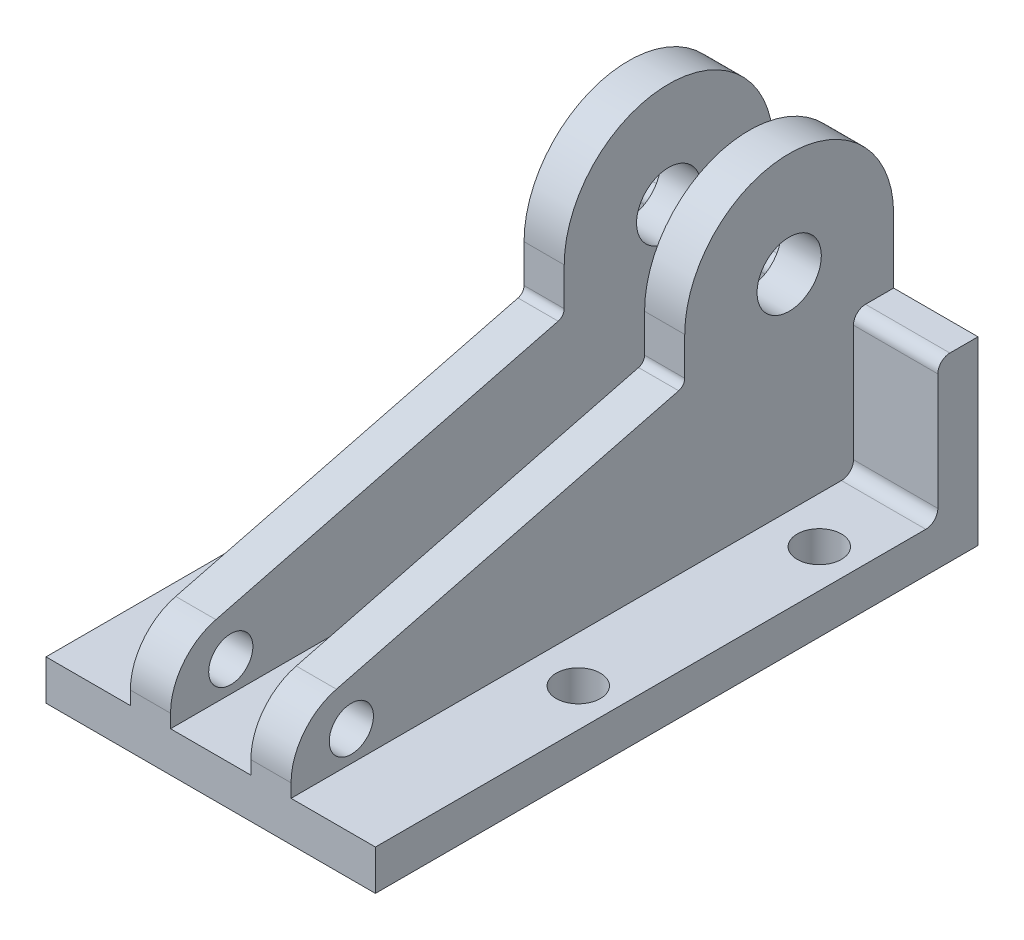
from build123d import *

# Parameters (mm, degrees)
SKETCH1_W                = 82
SKETCH1_H                = 150
BOSS_EXTRUDE1_DEPTH      = 10
SKETCH2_W                = 10
SKETCH2_H                = 45
BOSS_EXTRUDE2_DEPTH      = 82
BOSS_EXTRUDE3_DEPTH      = 42
BOSS_EXTRUDE3_DEPTH_BACK = 10
FILLET3_RADIUS           = 26
FILLET3_LENGTH           = 10
FILLET4_RADIUS           = 26
FILLET4_LENGTH           = 10
BOSS_EXTRUDE4_DEPTH      = 10
BOSS_EXTRUDE5_DEPTH      = 10
FILLET5_R                = 15
FILLET6_R                = 15
SKETCH6_R                = 8
SKETCH6_R_2              = 5.5
CUT_EXTRUDE1_DEPTH       = 131.057679512
FILLET7_R                = 3
FILLET8_R                = 3
FILLET9_R                = 3
FILLET10_R               = 3
FILLET11_R               = 2
SKETCH7_R                = 5.5
CUT_EXTRUDE2_DEPTH       = 116.043470045


with BuildPart() as part:
    # Sketch1 → Boss-Extrude1 (new body)
    with BuildSketch(Plane(origin=(0, 0, 0), x_dir=(1, 0, 0), z_dir=(0, 1, 0))):
        Rectangle(SKETCH1_W, SKETCH1_H)
    extrude(amount=BOSS_EXTRUDE1_DEPTH)

    # Sketch2 → Boss-Extrude2 (add, through all)
    with BuildSketch(Plane(origin=(41, 0, 0), x_dir=(0, 0, -1), z_dir=(1, 0, 0))):
        with Locations((70, 22.5)):
            Rectangle(SKETCH2_W, SKETCH2_H)
    extrude(amount=-BOSS_EXTRUDE2_DEPTH)

    # Sketch3 → Boss-Extrude3 (add, two sides: drawn at the far end of the back side and taken through both)
    with BuildSketch(Plane.XY.offset(-65).offset(-BOSS_EXTRUDE3_DEPTH_BACK)):
        Polygon((10, 45), (10, 10), (20, 10), (20, 45), (20, 87), (10, 87), align=None)
        Polygon((-10, 45), (-10, 87), (-20, 87), (-20, 45), (-20, 10), (-10, 10), align=None)
    extrude(amount=BOSS_EXTRUDE3_DEPTH + BOSS_EXTRUDE3_DEPTH_BACK)

    # Fillet3: full round fillet: the end face becomes a half cylinder, R = half its width
    fillet3_face = Plane((15, 87, -49), x_dir=(-1, 0, 0), z_dir=(0, 1, 0))  # on the end face: x along it, z out of the body
    fillet3_slab = fillet3_face.offset(-FILLET3_RADIUS / 2) * Box(FILLET3_LENGTH, 2 * FILLET3_RADIUS, FILLET3_RADIUS, mode=Mode.PRIVATE)  # the body's end, R deep
    fillet3_round = Plane((15, 61, -49), x_dir=(0, 1, 0), z_dir=(-1, 0, 0)) * Cylinder(FILLET3_RADIUS, FILLET3_LENGTH, mode=Mode.PRIVATE)  # its axis R under the face
    add(fillet3_slab - fillet3_round, mode=Mode.SUBTRACT)

    # Fillet4: full round fillet: the end face becomes a half cylinder, R = half its width
    fillet4_face = Plane((-15, 87, -49), x_dir=(-1, 0, 0), z_dir=(0, 1, 0))  # on the end face: x along it, z out of the body
    fillet4_slab = fillet4_face.offset(-FILLET4_RADIUS / 2) * Box(FILLET4_LENGTH, 2 * FILLET4_RADIUS, FILLET4_RADIUS, mode=Mode.PRIVATE)  # the body's end, R deep
    fillet4_round = Plane((-15, 61, -49), x_dir=(0, 1, 0), z_dir=(-1, 0, 0)) * Cylinder(FILLET4_RADIUS, FILLET4_LENGTH, mode=Mode.PRIVATE)  # its axis R under the face
    add(fillet4_slab - fillet4_round, mode=Mode.SUBTRACT)

    # Sketch4 → Boss-Extrude4 (add)
    with BuildSketch(Plane(origin=(20, 0, 0), x_dir=(0, 0, -1), z_dir=(1, 0, 0))):
        Polygon((23, 10), (23, 50), (-75, 25), (-75, 10), align=None)
    extrude(amount=-BOSS_EXTRUDE4_DEPTH)

    # Sketch5 → Boss-Extrude5 (add)
    with BuildSketch(Plane.ZY.offset(20)):
        Polygon((-23, 50), (75, 25), (75, 10), (-23, 10), align=None)
    extrude(amount=-BOSS_EXTRUDE5_DEPTH)

    # Fillet5
    fillet5_edges = [part.edges().sort_by_distance(p)[0] for p in [
        (15, 25, 75),
    ]]
    fillet(fillet5_edges, radius=FILLET5_R)

    # Fillet6
    fillet6_edges = [part.edges().sort_by_distance(p)[0] for p in [
        (-15, 25, 75),
    ]]
    fillet(fillet6_edges, radius=FILLET6_R)

    # Sketch6 → Cut-Extrude1 (cut, through all)
    with BuildSketch(Plane(origin=(20, 0, 0), x_dir=(0, 0, -1), z_dir=(1, 0, 0))):
        with Locations((49, 61)):
            Circle(SKETCH6_R)
        with Locations((-60, 17.5)):
            Circle(SKETCH6_R_2)
    extrude(amount=-CUT_EXTRUDE1_DEPTH, mode=Mode.SUBTRACT)

    # Fillet7
    fillet7_edges = [part.edges().sort_by_distance(p)[0] for p in [
        (30.5, 45, -65),
    ]]
    fillet(fillet7_edges, radius=FILLET7_R)

    # Fillet8
    fillet8_edges = [part.edges().sort_by_distance(p)[0] for p in [
        (0, 45, -65),
    ]]
    fillet(fillet8_edges, radius=FILLET8_R)

    # Fillet9
    fillet9_edges = [part.edges().sort_by_distance(p)[0] for p in [
        (-30.5, 45, -65),
    ]]
    fillet(fillet9_edges, radius=FILLET9_R)

    # Fillet10
    fillet10_edges = [part.edges().sort_by_distance(p)[0] for p in [
        (30.5, 10, -65),
        (0, 10, -65),
        (-30.5, 10, -65),
    ]]
    fillet(fillet10_edges, radius=FILLET10_R)

    # Fillet11
    fillet11_edges = [part.edges().sort_by_distance(p)[0] for p in [
        (15, 50, -23),
        (-15, 50, -23),
    ]]
    fillet(fillet11_edges, radius=FILLET11_R)

    # Sketch7 → Cut-Extrude2 (cut, through all)
    with BuildSketch(Plane(origin=(0, 10, 0), x_dir=(1, 0, 0), z_dir=(0, 1, 0))):
        with Locations(Location((31.5, 45, 0), (0, 0, 270))):
            Circle(SKETCH7_R)
        with Locations(Location((31.5, -15, 0), (0, 0, 270))):
            Circle(SKETCH7_R)
        with Locations(Location((-31.5, -15, 0), (0, 0, 90))):
            Circle(SKETCH7_R)
        with Locations(Location((-31.5, 45, 0), (0, 0, 90))):
            Circle(SKETCH7_R)
    extrude(amount=-CUT_EXTRUDE2_DEPTH, mode=Mode.SUBTRACT)


solid = part.part
